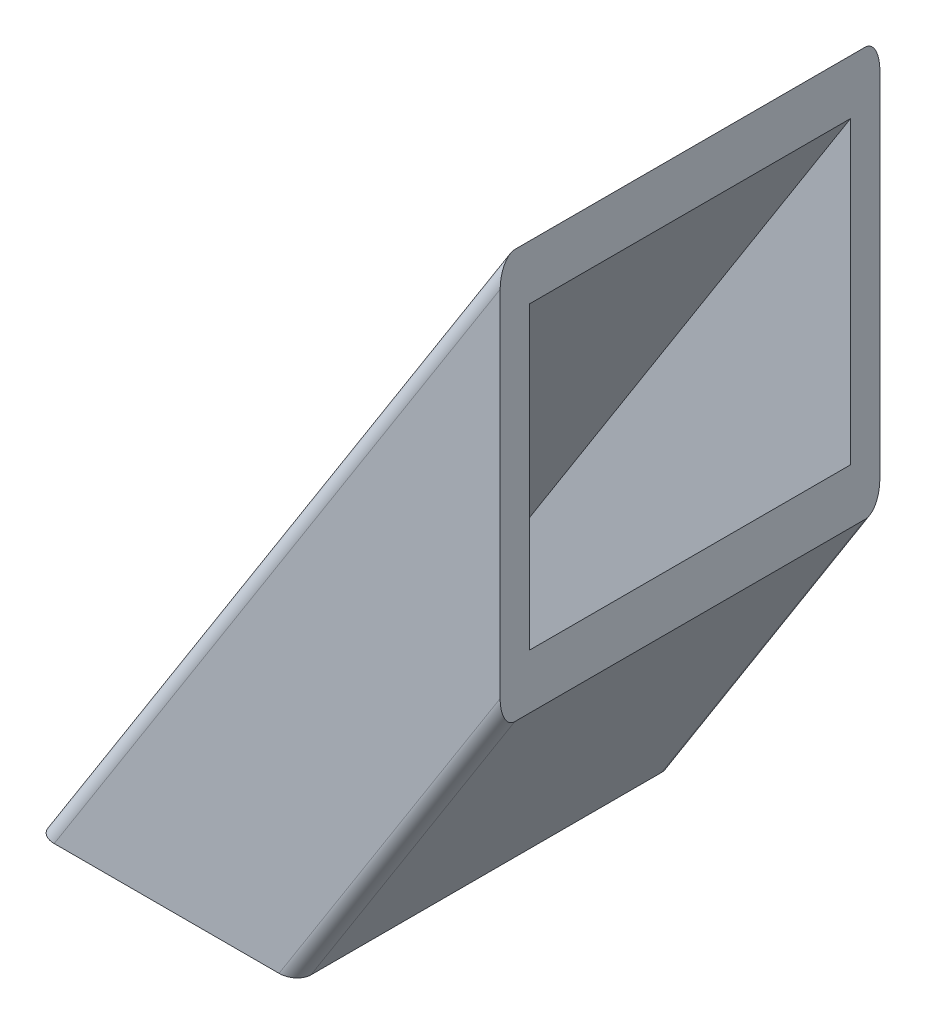
from build123d import *

# Parameters (mm, degrees)
BOSS_EXTRUDE1_DEPTH = 26
SHELL1_T            = -2
CUT_EXTRUDE1_REACH  = 59.407
SKETCH2_W           = 13.02701198
SKETCH2_H           = 22
FILLET1_R           = 1


with BuildPart() as part:
    # Sketch1 → Boss-Extrude1 (new body)
    with BuildSketch(Plane.XY):
        Polygon((0, 0), (-17.764107246, 0), (13.957512836, 50), (13.957512836, 22), align=None)
    extrude(amount=BOSS_EXTRUDE1_DEPTH)

    # Shell1
    shell1_openings = [part.faces().sort_by_distance(p)[0] for p in [
        (13.957512836, 36, 13),
    ]]
    offset(amount=SHELL1_T, openings=shell1_openings, kind=Kind.INTERSECTION)

    # Sketch2 → Cut-Extrude1 (cut, up to next)
    with BuildSketch(Plane(origin=(0, 2, 0), x_dir=(1, 0, 0), z_dir=(0, 1, 0)), mode=Mode.PRIVATE) as cut_extrude1_sk1:
        with Locations((-7.61318882, -13)):
            Rectangle(SKETCH2_W, SKETCH2_H)
    cut_extrude1_tool1 = extrude(cut_extrude1_sk1.sketch, amount=-CUT_EXTRUDE1_REACH, mode=Mode.PRIVATE) & part.part
    add(cut_extrude1_tool1.solids().sort_by_distance((-7.613189, 2, 13))[0], mode=Mode.SUBTRACT)

    # Fillet1
    fillet1_edges = [part.edges().sort_by_distance(p)[0] for p in [
        (-1.903297205, 25, 26),
        (6.978756418, 11, 26),
        (-1.903297205, 25, 0),
        (6.978756418, 11, 0),
    ]]
    fillet(fillet1_edges, radius=FILLET1_R)


solid = part.part
